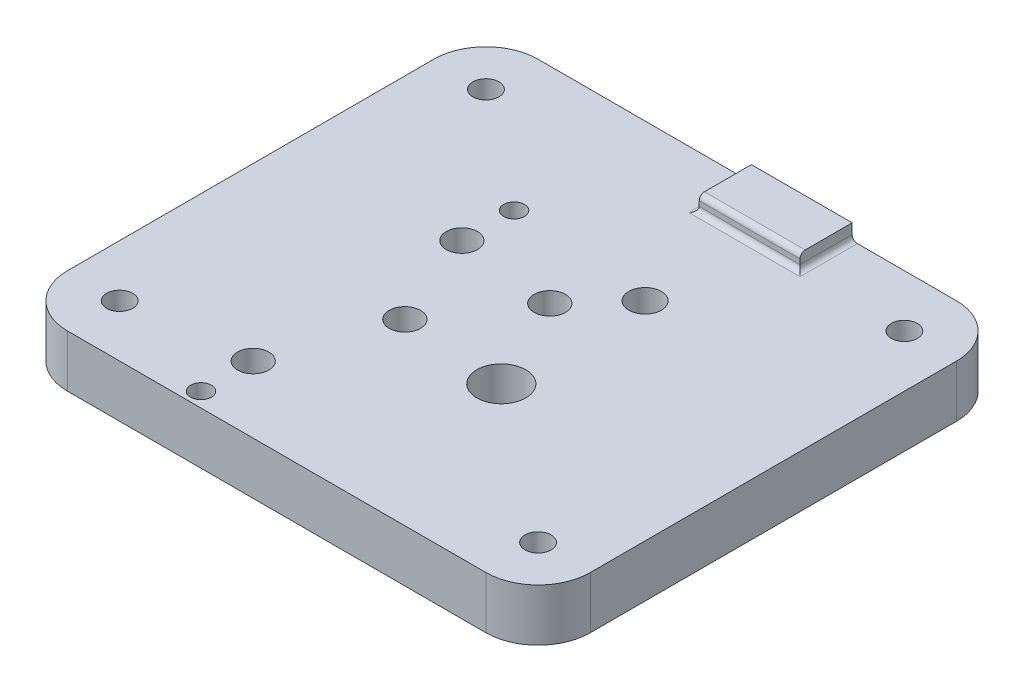
from build123d import *

# Parameters (mm, degrees)
BOSS_EXTRUDE1_DEPTH = 12.7
SKETCH5_R           = 11.9126
SKETCH5_R_2         = 7.9375
SKETCH5_R_3         = 5.9563
CUT_EXTRUDE3_DEPTH  = 231.35713577
CUT_EXTRUDE4_DEPTH  = 231.35713577
CUT_EXTRUDE5_DEPTH  = 7.5057
SKETCH8_R           = 6.35
CUT_EXTRUDE6_DEPTH  = 187.663093698
BOSS_EXTRUDE2_DEPTH = 25.4
SKETCH10_W          = 49.05855317
SKETCH10_H          = 25.4
BOSS_EXTRUDE3_DEPTH = 7.493
FILLET1_R           = 2.54
SKETCH11_R          = 5.08
CUT_EXTRUDE7_DEPTH  = 17.78
SKETCH12_R          = 7.62
CUT_EXTRUDE8_DEPTH  = 188.531502891
SKETCH14_R          = 5.08
BOSS_EXTRUDE4_DEPTH = 50.8
SKETCH16_R          = 7.62
CUT_EXTRUDE10_DEPTH = 193.622803885
SKETCH17_R          = 5.08
CUT_EXTRUDE11_DEPTH = 193.622803885


with BuildPart() as part:
    # Sketch2 → Boss-Extrude1 (new, symmetric)
    with BuildSketch(Plane(origin=(0, 0, 0), x_dir=(1, 0, 0), z_dir=(0, 1, 0))):
        Polygon((114.3, 127), (190.5, 76.2), (190.5, -76.2), (114.3, -127), (-114.3, -127), (-190.5, -76.2), (-190.5, 76.2), (-114.3, 127), align=None)
    extrude(amount=BOSS_EXTRUDE1_DEPTH, both=True)

    # Sketch5 → Cut-Extrude3 (cut, through all)
    # profile 1 of 3: a face of its own
    with BuildSketch(Plane(origin=(0, 12.7, 0), x_dir=(1, 0, 0), z_dir=(0, 1, 0))):
        with Locations(Location((11.947126713, -37.290041101, 0), (0, 0, 270))):
            Circle(SKETCH5_R)
    # profile 2 of 3: a face of its own
    with BuildSketch(Plane(origin=(0, 12.7, 0), x_dir=(1, 0, 0), z_dir=(0, 1, 0))):
        with Locations(Location((11.947126713, 32.712358899, 0), (0, 0, 270))):
            Circle(SKETCH5_R_2)
        with Locations((11.947126713, 32.712358899)):
            Circle(SKETCH5_R_3, mode=Mode.SUBTRACT)
    # profile 3 of 3: a face of its own
    with BuildSketch(Plane(origin=(0, 12.7, 0), x_dir=(1, 0, 0), z_dir=(0, 1, 0))):
        with Locations((11.947126713, 32.712358899)):
            Circle(SKETCH5_R_3)
    extrude(amount=-CUT_EXTRUDE3_DEPTH, mode=Mode.SUBTRACT)

    # Sketch6 → Cut-Extrude4 (cut, through all)
    with BuildSketch(Plane(origin=(0, 12.7, 0), x_dir=(1, 0, 0), z_dir=(0, 1, 0))):
        Polygon((-114.3, -127), (114.3, -127), (190.5, -76.2), (190.5, 76.2), (114.3, 127), (-114.3, 127), (-190.5, 76.2), (-190.5, -76.2), align=None)
        Polygon((-141.354573287, 83.118658899), (-115.954573287, 108.518658899), (87.753426713, 108.518658899), (113.153426713, 83.118658899), (113.153426713, -95.189341101), (87.753426713, -120.589341101), (-115.954573287, -120.589341101), (-141.354573287, -95.189341101), align=None, mode=Mode.SUBTRACT)
    extrude(amount=-CUT_EXTRUDE4_DEPTH, mode=Mode.SUBTRACT)

    # Sketch7 → Cut-Extrude5 (cut)
    with BuildSketch(Plane.XZ.offset(12.7)):
        with BuildLine():
            ThreePointArc((83.29952358, 107.082731992), (78.773170592, 86.20908498), (99.646817604, 90.735437968))
            Line((99.646817604, 90.735437968), (83.29952358, 107.082731992))
        make_face()
        with BuildLine():
            Line((83.29952358, 107.082731992), (99.646817604, 90.735437968))
            ThreePointArc((99.646817604, 90.735437968), (100.250147569, 92.926164607), (100.453426713, 95.189341101))
            ThreePointArc((100.453426713, 95.189341101), (94.989635327, 105.626164607), (83.29952358, 107.082731992))
        make_face()
        with BuildLine():
            ThreePointArc((-103.254573287, 95.189341101), (-105.517749781, 102.425549715), (-111.500670154, 107.082731992))
            Line((-111.500670154, 107.082731992), (-127.847964178, 90.735437968))
            ThreePointArc((-127.847964178, 90.735437968), (-113.691396793, 82.692620245), (-103.254573287, 95.189341101))
        make_face()
        with BuildLine():
            Line((-127.847964178, 90.735437968), (-111.500670154, 107.082731992))
            ThreePointArc((-111.500670154, 107.082731992), (-124.934829408, 104.169597223), (-127.847964178, 90.735437968))
        make_face()
        with BuildLine():
            ThreePointArc((100.453426713, -83.118658899), (100.250147569, -80.855482405), (99.646817604, -78.664755766))
            Line((99.646817604, -78.664755766), (83.29952358, -95.012049789))
            ThreePointArc((83.29952358, -95.012049789), (94.989635327, -93.555482405), (100.453426713, -83.118658899))
        make_face()
        with BuildLine():
            Line((83.29952358, -95.012049789), (99.646817604, -78.664755766))
            ThreePointArc((99.646817604, -78.664755766), (78.773170592, -74.138402777), (83.29952358, -95.012049789))
        make_face()
        with BuildLine():
            ThreePointArc((-127.847964178, -78.664755766), (-124.934829408, -92.09891502), (-111.500670154, -95.012049789))
            Line((-111.500670154, -95.012049789), (-127.847964178, -78.664755766))
        make_face()
        with BuildLine():
            Line((-127.847964178, -78.664755766), (-111.500670154, -95.012049789))
            ThreePointArc((-111.500670154, -95.012049789), (-105.517749781, -90.354867513), (-103.254573287, -83.118658899))
            ThreePointArc((-103.254573287, -83.118658899), (-113.691396793, -70.621938042), (-127.847964178, -78.664755766))
        make_face()
    extrude(amount=-CUT_EXTRUDE5_DEPTH, mode=Mode.SUBTRACT)

    # Sketch8 → Cut-Extrude6 (cut, through all)
    with BuildSketch(Plane.XZ.offset(5.1943)):
        with Locations(Location((-115.954573287, 95.189341101, 0), (0, 0, 270))):
            Circle(SKETCH8_R)
        with Locations(Location((87.753426713, 95.189341101, 0), (0, 0, 270))):
            Circle(SKETCH8_R)
        with Locations(Location((87.753426713, -83.118658899, 0), (0, 0, 270))):
            Circle(SKETCH8_R)
        with Locations(Location((-115.954573287, -83.118658899, 0), (0, 0, 270))):
            Circle(SKETCH8_R)
    extrude(amount=-CUT_EXTRUDE6_DEPTH, mode=Mode.SUBTRACT)

    # Sketch9 → Boss-Extrude2 (add)
    with BuildSketch(Plane(origin=(0, 12.7, 0), x_dir=(1, 0, 0), z_dir=(0, 1, 0))):
        with BuildLine():
            ThreePointArc((113.153426713, 83.118658899), (105.713938955, 101.079171141), (87.753426713, 108.518658899))
            Line((87.753426713, 108.518658899), (113.153426713, 83.118658899))
        make_face()
        with BuildLine():
            ThreePointArc((-115.954573287, 108.518658899), (-133.915085529, 101.079171141), (-141.354573287, 83.118658899))
            Line((-141.354573287, 83.118658899), (-115.954573287, 108.518658899))
        make_face()
        with BuildLine():
            ThreePointArc((-115.954573287, -120.589341101), (-133.915085529, -113.149853344), (-141.354573287, -95.189341101))
            Line((-141.354573287, -95.189341101), (-115.954573287, -120.589341101))
        make_face()
        with BuildLine():
            ThreePointArc((87.753426713, -120.589341101), (105.713938955, -113.149853344), (113.153426713, -95.189341101))
            Line((113.153426713, -95.189341101), (87.753426713, -120.589341101))
        make_face()
    extrude(amount=-BOSS_EXTRUDE2_DEPTH)

    # Sketch10 → Boss-Extrude3 (add)
    with BuildSketch(Plane(origin=(0, 12.7, 0), x_dir=(1, 0, 0), z_dir=(0, 1, 0))):
        with Locations((12.424150128, 95.818658899)):
            Rectangle(SKETCH10_W, SKETCH10_H)
    extrude(amount=BOSS_EXTRUDE3_DEPTH)

    # Fillet1
    fillet1_edges = [part.edges().sort_by_distance(p)[0] for p in [
        (-12.105126457, 12.7, -95.818658899),
        (12.424150128, 12.7, -83.118658899),
        (12.424150128, 20.193, -83.118658899),
        (36.953426713, 12.7, -95.818658899),
    ]]
    fillet(fillet1_edges, radius=FILLET1_R)

    # Sketch11 → Cut-Extrude7 (cut)
    with BuildSketch(Plane(origin=(0, 0, -108.518658899), x_dir=(-1, 0, 0), z_dir=(0, 0, -1))):
        with Locations((0.275849872, 3.7465)):
            Circle(SKETCH11_R)
        with Locations((-25.124150128, 3.7465)):
            Circle(SKETCH11_R)
    extrude(amount=-CUT_EXTRUDE7_DEPTH, mode=Mode.SUBTRACT)

    # Sketch12 → Cut-Extrude8 (cut, through all)
    with BuildSketch(Plane(origin=(0, 12.7, 0), x_dir=(1, 0, 0), z_dir=(0, 1, 0))):
        with Locations(Location((-10.178064282, 8.438679889, 0), (0, 0, 270))):
            Circle(SKETCH12_R)
        with Locations(Location((-38.717702845, -33.586658072, 0), (0, 0, 270))):
            Circle(SKETCH12_R)
    extrude(amount=-CUT_EXTRUDE8_DEPTH, mode=Mode.SUBTRACT)

    # Sketch14 → Boss-Extrude4 (add)
    with BuildSketch(Plane(origin=(0, 12.7, 0), x_dir=(1, 0, 0), z_dir=(0, 1, 0))):
        with Locations(Location((-58.055273287, -37.290041101, 0), (0, 0, 270))):
            Circle(SKETCH14_R)
    extrude(amount=-BOSS_EXTRUDE4_DEPTH)

    # Sketch16 → Cut-Extrude10 (cut, through all)
    with BuildSketch(Plane(origin=(0, 12.7, 0), x_dir=(1, 0, 0), z_dir=(0, 1, 0))):
        with Locations(Location((-58.055273287, 13.509958899, 0), (0, 0, 270))):
            Circle(SKETCH16_R)
        with Locations(Location((-58.055273287, -88.090041101, 0), (0, 0, 270))):
            Circle(SKETCH16_R)
    extrude(amount=-CUT_EXTRUDE10_DEPTH, mode=Mode.SUBTRACT)

    # Sketch17 → Cut-Extrude11 (cut, through all)
    with BuildSketch(Plane(origin=(0, 12.7, 0), x_dir=(1, 0, 0), z_dir=(0, 1, 0))):
        with Locations(Location((-58.055273287, 38.909958899, 0), (0, 0, 270))):
            Circle(SKETCH17_R)
        with Locations(Location((-58.055273287, -113.490041101, 0), (0, 0, 270))):
            Circle(SKETCH17_R)
    extrude(amount=-CUT_EXTRUDE11_DEPTH, mode=Mode.SUBTRACT)


solid = part.part
